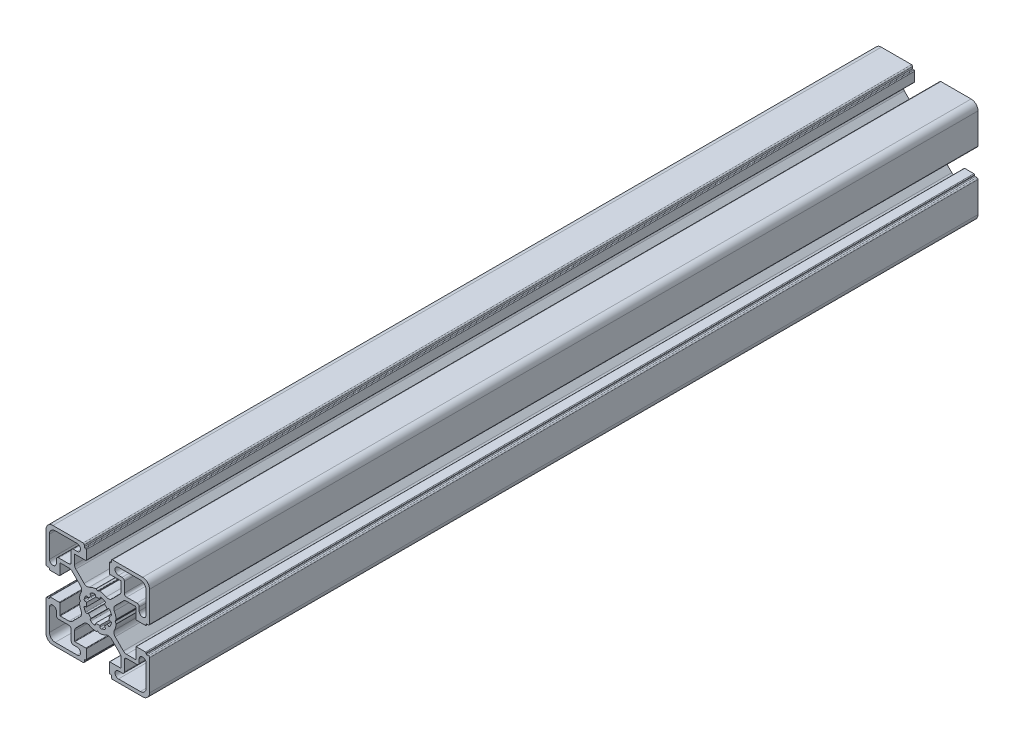
from build123d import *

# Parameters (mm, degrees)
BASE_EXTRUDE_DEPTH = 360
SKETCH2_R          = 4.2
CUT_EXTRUDE1_DEPTH = 164


with BuildPart() as part:
    # Sketch1 → Base-Extrude (new body)
    with BuildSketch(Plane.XY):
        with BuildLine():
            Line((7.973976585, 0.792591518), (7.540060475, 0.046829556))
            ThreePointArc((7.540060475, 0.046829556), (7.534295984, 0.023675638), (7.531329941, 0))
            ThreePointArc((7.531329941, 0), (7.534295984, -0.023675638), (7.540060475, -0.046829556))
            Line((7.540060475, -0.046829556), (7.973976585, -0.792591518))
            ThreePointArc((7.973976585, -0.792591518), (7.996666421, -0.851255641), (8.000014047, -0.914065683))
            ThreePointArc((8.000014047, -0.914065683), (7.719730741, -2.298395946), (7.20036345, -3.611859543))
            ThreePointArc((7.20036345, -3.611859543), (7.018857217, -4.793954471), (7.563483933, -5.85869607))
            Line((7.563483933, -5.85869607), (11.129779889, -9.424988026))
            ThreePointArc((11.129779889, -9.424988026), (11.760624613, -9.84650461), (12.504756513, -9.99452154))
            Line((12.504756513, -9.99452154), (16.316902451, -9.99452154))
            ThreePointArc((16.316902451, -9.99452154), (16.458324055, -9.935942793), (16.516902802, -9.794521189))
            Line((16.516902802, -9.794521189), (16.516902802, -5.200014226))
            ThreePointArc((16.516902802, -5.200014226), (16.575481548, -5.058592621), (16.716903152, -5.000013875))
            Line((16.716903152, -5.000013875), (20.719599904, -5.000013875))
            ThreePointArc((20.719599904, -5.000013875), (20.931731427, -5.087881629), (21.01959918, -5.300013151))
            Line((21.01959918, -5.300013151), (21.01959918, -5.500004099))
            ThreePointArc((21.01959918, -5.500004099), (21.10746708, -5.712135974), (21.319598956, -5.800003874))
            Line((21.319598956, -5.800003874), (21.999979514, -5.800003874))
            ThreePointArc((21.999979514, -5.800003874), (22.35353264, -5.946450374), (22.49997914, -6.300003501))
            Line((22.49997914, -6.300003501), (22.49997914, -19.500016116))
            ThreePointArc((22.49997914, -19.500016116), (21.62130014, -21.621334875), (19.499981381, -22.500013875))
            Line((19.499981381, -22.500013875), (6.375709012, -22.500013875))
            ThreePointArc((6.375709012, -22.500013875), (6.022155886, -22.353567375), (5.875709386, -22.000014249))
            Line((5.875709386, -22.000014249), (5.875709386, -21.30001315))
            ThreePointArc((5.875709386, -21.30001315), (5.787841632, -21.087881628), (5.57571011, -21.000013874))
            Line((5.57571011, -21.000013874), (5.299998776, -21.000013874))
            ThreePointArc((5.299998776, -21.000013874), (5.087867607, -20.912146267), (5, -20.700015099))
            Line((5, -20.700015099), (5, -16.666812433))
            ThreePointArc((5, -16.666812433), (5.058578893, -16.525390475), (5.200000851, -16.466811582))
            Line((5.200000851, -16.466811582), (9.905385218, -16.466811582))
            ThreePointArc((9.905385218, -16.466811582), (10.046806822, -16.408232835), (10.105385569, -16.266811231))
            Line((10.105385569, -16.266811231), (10.105385569, -12.471582956))
            ThreePointArc((10.105385569, -12.471582956), (9.953144588, -11.706215861), (9.519598955, -11.057368968))
            Line((9.519598955, -11.057368968), (5.944897989, -7.482668002))
            ThreePointArc((5.944897989, -7.482668002), (4.854601835, -6.967833724), (3.666499237, -7.173289937))
            ThreePointArc((3.666499237, -7.173289937), (2.309136684, -7.713848333), (0.876396038, -8.000013875))
            ThreePointArc((0.876396038, -8.000013875), (0.81356491, -7.997088573), (0.754749577, -7.974793627))
            Line((0.754749577, -7.974793627), (0.11262846, -7.606936933))
            ThreePointArc((0.11262846, -7.606936933), (0.062963903, -7.559088739), (0, -7.530953975))
            ThreePointArc((0, -7.530953975), (-0.062963903, -7.559088739), (-0.11262846, -7.606936933))
            Line((-0.11262846, -7.606936933), (-0.754749577, -7.974793627))
            ThreePointArc((-0.754749577, -7.974793627), (-0.81356491, -7.997088573), (-0.876396038, -8.000013875))
            ThreePointArc((-0.876396038, -8.000013875), (-2.309136684, -7.713848333), (-3.666499237, -7.173289937))
            ThreePointArc((-3.666499237, -7.173289937), (-4.854601835, -6.967833724), (-5.944897989, -7.482668002))
            Line((-5.944897989, -7.482668002), (-9.519598955, -11.057368968))
            ThreePointArc((-9.519598955, -11.057368968), (-9.953144588, -11.706215861), (-10.105385569, -12.471582956))
            Line((-10.105385569, -12.471582956), (-10.105385569, -16.266811231))
            ThreePointArc((-10.105385569, -16.266811231), (-10.046806822, -16.408232835), (-9.905385218, -16.466811582))
            Line((-9.905385218, -16.466811582), (-5.200000851, -16.466811582))
            ThreePointArc((-5.200000851, -16.466811582), (-5.058578893, -16.525390475), (-5, -16.666812433))
            Line((-5, -16.666812433), (-5, -20.700015099))
            ThreePointArc((-5, -20.700015099), (-5.087867607, -20.912146267), (-5.299998776, -21.000013874))
            Line((-5.299998776, -21.000013874), (-5.57571011, -21.000013874))
            ThreePointArc((-5.57571011, -21.000013874), (-5.787841632, -21.087881628), (-5.875709386, -21.30001315))
            Line((-5.875709386, -21.30001315), (-5.875709386, -22.000014249))
            ThreePointArc((-5.875709386, -22.000014249), (-6.022155886, -22.353567375), (-6.375709012, -22.500013875))
            Line((-6.375709012, -22.500013875), (-19.499981381, -22.500013875))
            ThreePointArc((-19.499981381, -22.500013875), (-21.62130014, -21.621334875), (-22.49997914, -19.500016116))
            Line((-22.49997914, -19.500016116), (-22.49997914, -6.300003501))
            ThreePointArc((-22.49997914, -6.300003501), (-22.35353264, -5.946450374), (-21.999979514, -5.800003874))
            Line((-21.999979514, -5.800003874), (-21.319598956, -5.800003874))
            ThreePointArc((-21.319598956, -5.800003874), (-21.10746708, -5.712135974), (-21.01959918, -5.500004099))
            Line((-21.01959918, -5.500004099), (-21.01959918, -5.300013151))
            ThreePointArc((-21.01959918, -5.300013151), (-20.931731427, -5.087881629), (-20.719599904, -5.000013875))
            Line((-20.719599904, -5.000013875), (-16.716903152, -5.000013875))
            ThreePointArc((-16.716903152, -5.000013875), (-16.575481548, -5.058592621), (-16.516902802, -5.200014226))
            Line((-16.516902802, -5.200014226), (-16.516902802, -9.794521189))
            ThreePointArc((-16.516902802, -9.794521189), (-16.458324055, -9.935942793), (-16.316902451, -9.99452154))
            Line((-16.316902451, -9.99452154), (-12.504756513, -9.99452154))
            ThreePointArc((-12.504756513, -9.99452154), (-11.760624613, -9.84650461), (-11.129779889, -9.424988026))
            Line((-11.129779889, -9.424988026), (-7.563483933, -5.85869607))
            ThreePointArc((-7.563483933, -5.85869607), (-7.018857217, -4.793954471), (-7.20036345, -3.611859543))
            ThreePointArc((-7.20036345, -3.611859543), (-7.719730741, -2.298395946), (-8.000014047, -0.914065683))
            ThreePointArc((-8.000014047, -0.914065683), (-7.996666421, -0.851255641), (-7.973976585, -0.792591518))
            Line((-7.973976585, -0.792591518), (-7.540060475, -0.046829556))
            ThreePointArc((-7.540060475, -0.046829556), (-7.534295984, -0.023675638), (-7.531329941, 0))
            ThreePointArc((-7.531329941, 0), (-7.534295984, 0.023675638), (-7.540060475, 0.046829556))
            Line((-7.540060475, 0.046829556), (-7.973976585, 0.792591518))
            ThreePointArc((-7.973976585, 0.792591518), (-7.996666421, 0.851255641), (-8.000014047, 0.914065683))
            ThreePointArc((-8.000014047, 0.914065683), (-7.719730741, 2.298395946), (-7.20036345, 3.611859543))
            ThreePointArc((-7.20036345, 3.611859543), (-7.018857217, 4.793954471), (-7.563483933, 5.85869607))
            Line((-7.563483933, 5.85869607), (-11.129779889, 9.424988026))
            ThreePointArc((-11.129779889, 9.424988026), (-11.760624613, 9.84650461), (-12.504756513, 9.99452154))
            Line((-12.504756513, 9.99452154), (-16.316902451, 9.99452154))
            ThreePointArc((-16.316902451, 9.99452154), (-16.458324055, 9.935942793), (-16.516902802, 9.794521189))
            Line((-16.516902802, 9.794521189), (-16.516902802, 5.200014226))
            ThreePointArc((-16.516902802, 5.200014226), (-16.575481548, 5.058592621), (-16.716903152, 5.000013875))
            Line((-16.716903152, 5.000013875), (-20.719599904, 5.000013875))
            ThreePointArc((-20.719599904, 5.000013875), (-20.931731427, 5.087881629), (-21.01959918, 5.300013151))
            Line((-21.01959918, 5.300013151), (-21.01959918, 5.500004099))
            ThreePointArc((-21.01959918, 5.500004099), (-21.10746708, 5.712135974), (-21.319598956, 5.800003874))
            Line((-21.319598956, 5.800003874), (-21.999979514, 5.800003874))
            ThreePointArc((-21.999979514, 5.800003874), (-22.35353264, 5.946450374), (-22.49997914, 6.300003501))
            Line((-22.49997914, 6.300003501), (-22.49997914, 19.500016116))
            ThreePointArc((-22.49997914, 19.500016116), (-21.62130014, 21.621334875), (-19.499981381, 22.500013875))
            Line((-19.499981381, 22.500013875), (-6.375709012, 22.500013875))
            ThreePointArc((-6.375709012, 22.500013875), (-6.022155886, 22.353567375), (-5.875709386, 22.000014249))
            Line((-5.875709386, 22.000014249), (-5.875709386, 21.30001315))
            ThreePointArc((-5.875709386, 21.30001315), (-5.787841632, 21.087881628), (-5.57571011, 21.000013874))
            Line((-5.57571011, 21.000013874), (-5.299998776, 21.000013874))
            ThreePointArc((-5.299998776, 21.000013874), (-5.087867607, 20.912146267), (-5, 20.700015099))
            Line((-5, 20.700015099), (-5, 16.666812433))
            ThreePointArc((-5, 16.666812433), (-5.058578893, 16.525390475), (-5.200000851, 16.466811582))
            Line((-5.200000851, 16.466811582), (-9.905385218, 16.466811582))
            ThreePointArc((-9.905385218, 16.466811582), (-10.046806822, 16.408232835), (-10.105385569, 16.266811231))
            Line((-10.105385569, 16.266811231), (-10.105385569, 12.471582956))
            ThreePointArc((-10.105385569, 12.471582956), (-9.953144588, 11.706215861), (-9.519598955, 11.057368968))
            Line((-9.519598955, 11.057368968), (-5.944897989, 7.482668002))
            ThreePointArc((-5.944897989, 7.482668002), (-4.854601835, 6.967833724), (-3.666499237, 7.173289937))
            ThreePointArc((-3.666499237, 7.173289937), (-2.309136684, 7.713848333), (-0.876396038, 8.000013875))
            ThreePointArc((-0.876396038, 8.000013875), (-0.81356491, 7.997088573), (-0.754749577, 7.974793627))
            Line((-0.754749577, 7.974793627), (-0.11262846, 7.606936933))
            ThreePointArc((-0.11262846, 7.606936933), (-0.062963903, 7.559088739), (0, 7.530953975))
            ThreePointArc((0, 7.530953975), (0.062963903, 7.559088739), (0.11262846, 7.606936933))
            Line((0.11262846, 7.606936933), (0.754749577, 7.974793627))
            ThreePointArc((0.754749577, 7.974793627), (0.81356491, 7.997088573), (0.876396038, 8.000013875))
            ThreePointArc((0.876396038, 8.000013875), (2.309136684, 7.713848333), (3.666499237, 7.173289937))
            ThreePointArc((3.666499237, 7.173289937), (4.854601835, 6.967833724), (5.944897989, 7.482668002))
            Line((5.944897989, 7.482668002), (9.519598955, 11.057368968))
            ThreePointArc((9.519598955, 11.057368968), (9.953144588, 11.706215861), (10.105385569, 12.471582956))
            Line((10.105385569, 12.471582956), (10.105385569, 16.266811231))
            ThreePointArc((10.105385569, 16.266811231), (10.046806822, 16.408232835), (9.905385218, 16.466811582))
            Line((9.905385218, 16.466811582), (5.200000851, 16.466811582))
            ThreePointArc((5.200000851, 16.466811582), (5.058578893, 16.525390475), (5, 16.666812433))
            Line((5, 16.666812433), (5, 20.700015099))
            ThreePointArc((5, 20.700015099), (5.087867607, 20.912146267), (5.299998776, 21.000013874))
            Line((5.299998776, 21.000013874), (5.57571011, 21.000013874))
            ThreePointArc((5.57571011, 21.000013874), (5.787841632, 21.087881628), (5.875709386, 21.30001315))
            Line((5.875709386, 21.30001315), (5.875709386, 22.000014249))
            ThreePointArc((5.875709386, 22.000014249), (6.022155886, 22.353567375), (6.375709012, 22.500013875))
            Line((6.375709012, 22.500013875), (19.499981381, 22.500013875))
            ThreePointArc((19.499981381, 22.500013875), (21.62130014, 21.621334875), (22.49997914, 19.500016116))
            Line((22.49997914, 19.500016116), (22.49997914, 6.300003501))
            ThreePointArc((22.49997914, 6.300003501), (22.35353264, 5.946450374), (21.999979514, 5.800003874))
            Line((21.999979514, 5.800003874), (21.319598956, 5.800003874))
            ThreePointArc((21.319598956, 5.800003874), (21.10746708, 5.712135974), (21.01959918, 5.500004099))
            Line((21.01959918, 5.500004099), (21.01959918, 5.300013151))
            ThreePointArc((21.01959918, 5.300013151), (20.931731427, 5.087881629), (20.719599904, 5.000013875))
            Line((20.719599904, 5.000013875), (16.716903152, 5.000013875))
            ThreePointArc((16.716903152, 5.000013875), (16.575481548, 5.058592621), (16.516902802, 5.200014226))
            Line((16.516902802, 5.200014226), (16.516902802, 9.794521189))
            ThreePointArc((16.516902802, 9.794521189), (16.458324055, 9.935942793), (16.316902451, 9.99452154))
            Line((16.316902451, 9.99452154), (12.504756513, 9.99452154))
            ThreePointArc((12.504756513, 9.99452154), (11.760624613, 9.84650461), (11.129779889, 9.424988026))
            Line((11.129779889, 9.424988026), (7.563483933, 5.85869607))
            ThreePointArc((7.563483933, 5.85869607), (7.018857217, 4.793954471), (7.20036345, 3.611859543))
            ThreePointArc((7.20036345, 3.611859543), (7.719730741, 2.298395946), (8.000014047, 0.914065683))
            ThreePointArc((8.000014047, 0.914065683), (7.996666421, 0.851255641), (7.973976585, 0.792591518))
        make_face()
        with BuildLine():
            Line((10.549978885, 18.000013874), (8.999979138, 18.000013874))
            ThreePointArc((8.999979138, 18.000013874), (7.499979138, 19.500013874), (8.999979138, 21.000013874))
            Line((8.999979138, 21.000013874), (18.499981006, 21.000013874))
            ThreePointArc((18.499981006, 21.000013874), (20.267746638, 20.267781374), (20.999979138, 18.500015742))
            Line((20.999979138, 18.500015742), (20.999979138, 9.000204874))
            ThreePointArc((20.999979138, 9.000204874), (19.499979138, 7.500204874), (17.999979138, 9.000204874))
            Line((17.999979138, 9.000204874), (17.999979138, 10.550013621))
            ThreePointArc((17.999979138, 10.550013621), (17.707086138, 11.257119874), (16.999979885, 11.550012874))
            Line((16.999979885, 11.550012874), (12.549977391, 11.550012874))
            ThreePointArc((12.549977391, 11.550012874), (11.842871138, 11.842905874), (11.549978138, 12.550012127))
            Line((11.549978138, 12.550012127), (11.549978138, 17.000014621))
            ThreePointArc((11.549978138, 17.000014621), (11.257085138, 17.707120874), (10.549978885, 18.000013874))
        make_face(mode=Mode.SUBTRACT)
        with BuildLine():
            Line((-0.867388737, 4.924188946), (-0.96752168, 5.481112935))
            ThreePointArc((-0.96752168, 5.481112935), (-1.187855719, 5.829589164), (-1.595071417, 5.894072848))
            ThreePointArc((-1.595071417, 5.894072848), (-2.338895973, 5.643477696), (-3.04438497, 5.299445466))
            ThreePointArc((-3.04438497, 5.299445466), (-3.284615367, 4.964275075), (-3.191311906, 4.562598216))
            Line((-3.191311906, 4.562598216), (-2.864000421, 4.09847552))
            ThreePointArc((-2.864000421, 4.09847552), (-3.53013295, 3.540926624), (-4.08971289, 2.876499344))
            Line((-4.08971289, 2.876499344), (-4.566777651, 3.208162503))
            ThreePointArc((-4.566777651, 3.208162503), (-4.968960845, 3.298770682), (-5.302497889, 3.056460542))
            ThreePointArc((-5.302497889, 3.056460542), (-5.651259984, 2.353310881), (-5.906847665, 1.611199444))
            ThreePointArc((-5.906847665, 1.611199444), (-5.839752063, 1.204293023), (-5.489730697, 0.98621116))
            Line((-5.489730697, 0.98621116), (-4.920545766, 0.887822825))
            ThreePointArc((-4.920545766, 0.887822825), (-4.980096828, 0.445685524), (-5, 0))
            ThreePointArc((-5, 0), (-4.980096828, -0.445685524), (-4.920545766, -0.887822825))
            Line((-4.920545766, -0.887822825), (-5.489730697, -0.98621116))
            ThreePointArc((-5.489730697, -0.98621116), (-5.839752063, -1.204293023), (-5.906847665, -1.611199444))
            ThreePointArc((-5.906847665, -1.611199444), (-5.651259984, -2.353310881), (-5.302497889, -3.056460542))
            ThreePointArc((-5.302497889, -3.056460542), (-4.968960845, -3.298770682), (-4.566777651, -3.208162503))
            Line((-4.566777651, -3.208162503), (-4.08971289, -2.876499344))
            ThreePointArc((-4.08971289, -2.876499344), (-3.53013295, -3.540926624), (-2.864000421, -4.09847552))
            Line((-2.864000421, -4.09847552), (-3.191311906, -4.562598216))
            ThreePointArc((-3.191311906, -4.562598216), (-3.284615367, -4.964275075), (-3.04438497, -5.299445466))
            ThreePointArc((-3.04438497, -5.299445466), (-2.338895973, -5.643477696), (-1.595071417, -5.894072848))
            ThreePointArc((-1.595071417, -5.894072848), (-1.187855719, -5.829589164), (-0.96752168, -5.481112935))
            Line((-0.96752168, -5.481112935), (-0.867388737, -4.924188946))
            ThreePointArc((-0.867388737, -4.924188946), (0, -5), (0.867388737, -4.924188946))
            Line((0.867388737, -4.924188946), (0.96752168, -5.481112935))
            ThreePointArc((0.96752168, -5.481112935), (1.187855719, -5.829589164), (1.595071417, -5.894072848))
            ThreePointArc((1.595071417, -5.894072848), (2.338895973, -5.643477696), (3.04438497, -5.299445466))
            ThreePointArc((3.04438497, -5.299445466), (3.284615367, -4.964275075), (3.191311906, -4.562598216))
            Line((3.191311906, -4.562598216), (2.864000421, -4.09847552))
            ThreePointArc((2.864000421, -4.09847552), (3.53013295, -3.540926624), (4.08971289, -2.876499344))
            Line((4.08971289, -2.876499344), (4.566777651, -3.208162503))
            ThreePointArc((4.566777651, -3.208162503), (4.968960845, -3.298770682), (5.302497889, -3.056460542))
            ThreePointArc((5.302497889, -3.056460542), (5.651259984, -2.353310881), (5.906847665, -1.611199444))
            ThreePointArc((5.906847665, -1.611199444), (5.839752063, -1.204293023), (5.489730697, -0.98621116))
            Line((5.489730697, -0.98621116), (4.920545766, -0.887822825))
            ThreePointArc((4.920545766, -0.887822825), (4.980096828, -0.445685524), (5, 0))
            ThreePointArc((5, 0), (4.980096828, 0.445685524), (4.920545766, 0.887822825))
            Line((4.920545766, 0.887822825), (5.489730697, 0.98621116))
            ThreePointArc((5.489730697, 0.98621116), (5.839752063, 1.204293023), (5.906847665, 1.611199444))
            ThreePointArc((5.906847665, 1.611199444), (5.651259984, 2.353310881), (5.302497889, 3.056460542))
            ThreePointArc((5.302497889, 3.056460542), (4.968960845, 3.298770682), (4.566777651, 3.208162503))
            Line((4.566777651, 3.208162503), (4.08971289, 2.876499344))
            ThreePointArc((4.08971289, 2.876499344), (3.53013295, 3.540926624), (2.864000421, 4.09847552))
            Line((2.864000421, 4.09847552), (3.191311906, 4.562598216))
            ThreePointArc((3.191311906, 4.562598216), (3.284615367, 4.964275075), (3.04438497, 5.299445466))
            ThreePointArc((3.04438497, 5.299445466), (2.338895973, 5.643477696), (1.595071417, 5.894072848))
            ThreePointArc((1.595071417, 5.894072848), (1.187855719, 5.829589164), (0.96752168, 5.481112935))
            Line((0.96752168, 5.481112935), (0.867388737, 4.924188946))
            ThreePointArc((0.867388737, 4.924188946), (0, 5), (-0.867388737, 4.924188946))
        make_face(mode=Mode.SUBTRACT)
        with BuildLine():
            Line((-10.549978885, -18.000013874), (-8.999979138, -18.000013874))
            ThreePointArc((-8.999979138, -18.000013874), (-7.499979138, -19.500013874), (-8.999979138, -21.000013874))
            Line((-8.999979138, -21.000013874), (-18.499981006, -21.000013874))
            ThreePointArc((-18.499981006, -21.000013874), (-20.267746638, -20.267781374), (-20.999979138, -18.500015742))
            Line((-20.999979138, -18.500015742), (-20.999979138, -9.000204874))
            ThreePointArc((-20.999979138, -9.000204874), (-19.499979138, -7.500204874), (-17.999979138, -9.000204874))
            Line((-17.999979138, -9.000204874), (-17.999979138, -10.550013621))
            ThreePointArc((-17.999979138, -10.550013621), (-17.707086138, -11.257119874), (-16.999979885, -11.550012874))
            Line((-16.999979885, -11.550012874), (-12.549977391, -11.550012874))
            ThreePointArc((-12.549977391, -11.550012874), (-11.842871138, -11.842905874), (-11.549978138, -12.550012127))
            Line((-11.549978138, -12.550012127), (-11.549978138, -17.000014621))
            ThreePointArc((-11.549978138, -17.000014621), (-11.257085138, -17.707120874), (-10.549978885, -18.000013874))
        make_face(mode=Mode.SUBTRACT)
        with BuildLine():
            Line((-11.549978138, 12.550012127), (-11.549978138, 17.000014621))
            ThreePointArc((-11.549978138, 17.000014621), (-11.257085138, 17.707120874), (-10.549978885, 18.000013874))
            Line((-10.549978885, 18.000013874), (-8.999979138, 18.000013874))
            ThreePointArc((-8.999979138, 18.000013874), (-7.499979138, 19.500013874), (-8.999979138, 21.000013874))
            Line((-8.999979138, 21.000013874), (-18.499981006, 21.000013874))
            ThreePointArc((-18.499981006, 21.000013874), (-20.267746638, 20.267781374), (-20.999979138, 18.500015742))
            Line((-20.999979138, 18.500015742), (-20.999979138, 9.000204874))
            ThreePointArc((-20.999979138, 9.000204874), (-19.499979138, 7.500204874), (-17.999979138, 9.000204874))
            Line((-17.999979138, 9.000204874), (-17.999979138, 10.550013621))
            ThreePointArc((-17.999979138, 10.550013621), (-17.707086138, 11.257119874), (-16.999979885, 11.550012874))
            Line((-16.999979885, 11.550012874), (-12.549977391, 11.550012874))
            ThreePointArc((-12.549977391, 11.550012874), (-11.842871138, 11.842905874), (-11.549978138, 12.550012127))
        make_face(mode=Mode.SUBTRACT)
        with BuildLine():
            Line((11.549978138, -12.550012127), (11.549978138, -17.000014621))
            ThreePointArc((11.549978138, -17.000014621), (11.257085138, -17.707120874), (10.549978885, -18.000013874))
            Line((10.549978885, -18.000013874), (8.999979138, -18.000013874))
            ThreePointArc((8.999979138, -18.000013874), (7.499979138, -19.500013874), (8.999979138, -21.000013874))
            Line((8.999979138, -21.000013874), (18.499981006, -21.000013874))
            ThreePointArc((18.499981006, -21.000013874), (20.267746638, -20.267781374), (20.999979138, -18.500015742))
            Line((20.999979138, -18.500015742), (20.999979138, -9.000204874))
            ThreePointArc((20.999979138, -9.000204874), (19.499979138, -7.500204874), (17.999979138, -9.000204874))
            Line((17.999979138, -9.000204874), (17.999979138, -10.550013621))
            ThreePointArc((17.999979138, -10.550013621), (17.707086138, -11.257119874), (16.999979885, -11.550012874))
            Line((16.999979885, -11.550012874), (12.549977391, -11.550012874))
            ThreePointArc((12.549977391, -11.550012874), (11.842871138, -11.842905874), (11.549978138, -12.550012127))
        make_face(mode=Mode.SUBTRACT)
    extrude(amount=-BASE_EXTRUDE_DEPTH)

    # Sketch2 → Cut-Extrude1 (cut)
    with BuildSketch(Plane(origin=(22.49997914, 0, 0), x_dir=(0, 0, -1), z_dir=(1, 0, 0))):
        with Locations(Location((85, 0, 0), (0, 0, 102.623394564))):
            Circle(SKETCH2_R)
        with Locations(Location((45, 0, 0), (0, 0, 102.623394564))):
            Circle(SKETCH2_R)
    extrude(amount=-CUT_EXTRUDE1_DEPTH, mode=Mode.SUBTRACT)


solid = part.part
